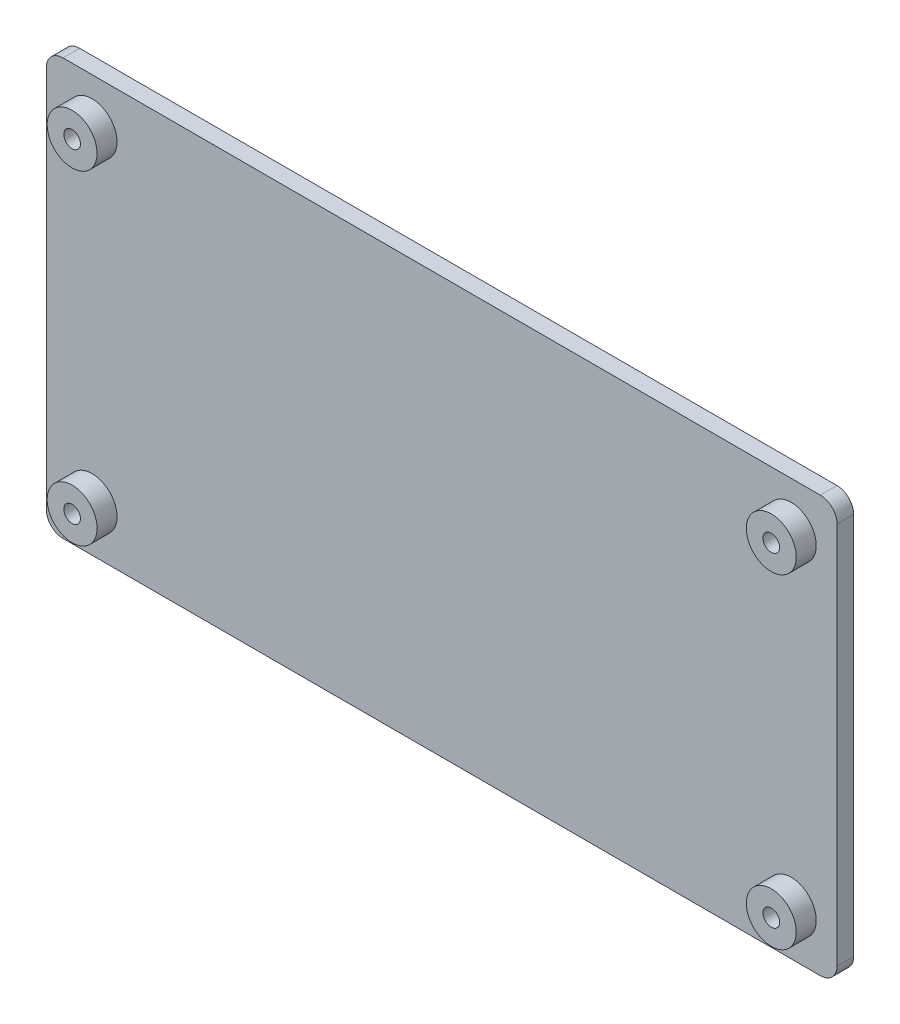
from build123d import *

# Parameters (mm, degrees)
SKETCH_1_W          = 95
SKETCH_1_H          = 50
EXTRUDE_1_DEPTH     = 2
EXTRUDE_START       = -2
SKETCH_3_R          = 3
EXTRUDE_3_DEPTH     = 2.4
SKETCH_4_R          = 2
CUT_EXTRUDE_1_DEPTH = 1.5
SKETCH_5_R          = 1
CUT_EXTRUDE_2_DEPTH = 54.857311481
FILLET_2_R          = 2


with BuildPart() as part:
    # 草图1 → 凸台-拉伸1 (new body)
    with BuildSketch(Plane.XY):
        Rectangle(SKETCH_1_W, SKETCH_1_H)
    extrude(amount=EXTRUDE_1_DEPTH)

    # 草图3 → 凸台-拉伸3 (add)
    with BuildSketch(Plane(origin=(0, 0, 0), x_dir=(-1, 0, 0), z_dir=(0, 0, -1)).offset(EXTRUDE_START)):
        with Locations((-42, 19.50009906)):
            Circle(SKETCH_3_R)
        with Locations((42.00021336, 19.50009906)):
            Circle(SKETCH_3_R)
        with Locations((42.00021336, -19.5)):
            Circle(SKETCH_3_R)
        with Locations((-42, -19.5)):
            Circle(SKETCH_3_R)
    extrude(amount=-EXTRUDE_3_DEPTH)

    # 草图4 → 切除-拉伸1 (cut)
    with BuildSketch(Plane(origin=(0, 0, 0), x_dir=(-1, 0, 0), z_dir=(0, 0, -1))):
        with Locations((-42, 19.50009906)):
            Circle(SKETCH_4_R)
        with Locations((-42, -19.5)):
            Circle(SKETCH_4_R)
        with Locations((42.00021336, 19.50009906)):
            Circle(SKETCH_4_R)
        with Locations((42.00021336, -19.5)):
            Circle(SKETCH_4_R)
    extrude(amount=-CUT_EXTRUDE_1_DEPTH, mode=Mode.SUBTRACT)

    # 草图5 → 切除-拉伸2 (cut, through all)
    with BuildSketch(Plane(origin=(0, 0, 0), x_dir=(-1, 0, 0), z_dir=(0, 0, -1))):
        with Locations((-42, 19.50009906)):
            Circle(SKETCH_5_R)
        with Locations((42.00021336, 19.50009906)):
            Circle(SKETCH_5_R)
        with Locations((42.00021336, -19.5)):
            Circle(SKETCH_5_R)
        with Locations((-42, -19.5)):
            Circle(SKETCH_5_R)
    extrude(amount=-CUT_EXTRUDE_2_DEPTH, mode=Mode.SUBTRACT)

    # 圆角2
    fillet_2_edges = [part.edges().sort_by_distance(p)[0] for p in [
        (47.5, -25, 1),
        (-47.5, -25, 1),
        (-47.5, 25, 1),
        (47.5, 25, 1),
    ]]
    fillet(fillet_2_edges, radius=FILLET_2_R)


solid = part.part
